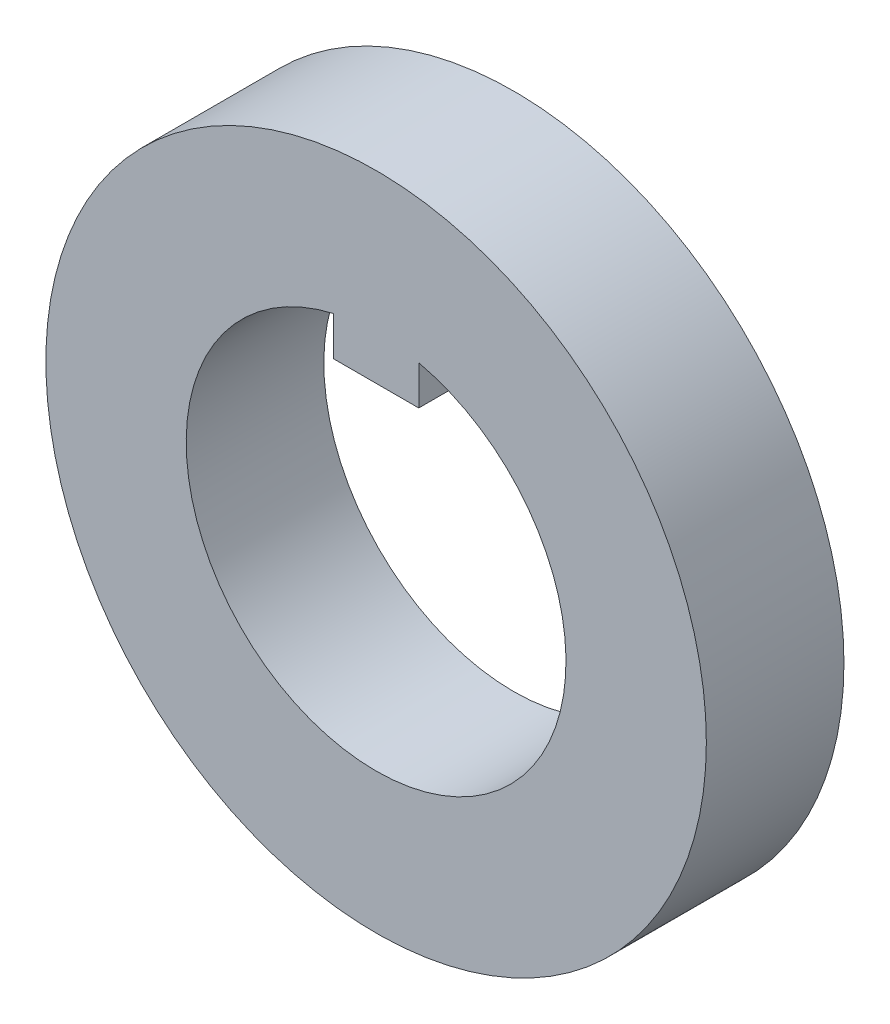
from build123d import *

# Parameters (mm, degrees)
SKETCH1_R           = 30.48
SKETCH1_W           = 7.874
SKETCH1_H           = 8.128
BOSS_EXTRUDE1_DEPTH = 12.7


with BuildPart() as part:
    # Sketch1 → Boss-Extrude1 (new body)
    # profile 1 of 2: a face of its own
    with BuildSketch(Plane.XY):
        Circle(SKETCH1_R)
        with BuildLine():
            Line((-3.937, 17.078076795), (-3.937, 21.59))
            Line((-3.937, 21.59), (3.937, 21.59))
            Line((3.937, 21.59), (3.937, 17.078076795))
            ThreePointArc((3.937, 17.078076795), (0, -17.526), (-3.937, 17.078076795))
        make_face(mode=Mode.SUBTRACT)
    # profile 2 of 2: a face of its own
    with BuildSketch(Plane.XY):
        with Locations((0, 17.526)):
            Rectangle(SKETCH1_W, SKETCH1_H)
    extrude(amount=BOSS_EXTRUDE1_DEPTH)


solid = part.part
